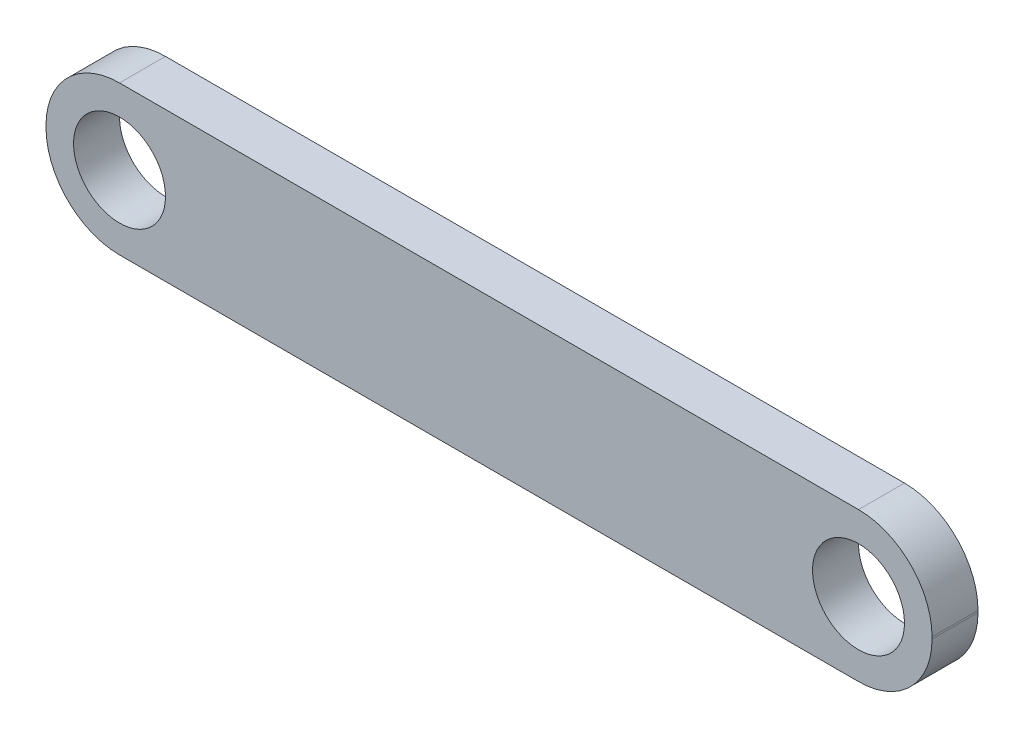
from build123d import *

# Parameters (mm, degrees)
SKETCH1_R           = 10
BOSS_EXTRUDE1_DEPTH = 10


with BuildPart() as part:
    # Sketch1 → Boss-Extrude1 (new body)
    with BuildSketch(Plane.XY):
        with BuildLine():
            Line((-97.749656725, -4.265612127), (63.056011424, -4.265612127))
            ThreePointArc((63.056011424, -4.265612127), (74.369719923, -8.951903628), (79.056011424, -20.265612127))
            Line((79.056011424, -20.265612127), (79.056011424, -20.684264294))
            ThreePointArc((79.056011424, -20.684264294), (74.369719923, -31.997972793), (63.056011424, -36.684264294))
            Line((63.056011424, -36.684264294), (-97.749656725, -36.684264294))
            ThreePointArc((-97.749656725, -36.684264294), (-109.063365224, -31.997972793), (-113.749656725, -20.684264294))
            Line((-113.749656725, -20.684264294), (-113.749656725, -20.265612127))
            ThreePointArc((-113.749656725, -20.265612127), (-109.063365224, -8.951903628), (-97.749656725, -4.265612127))
        make_face()
        with Locations((-97.749656725, -20.684264294)):
            Circle(SKETCH1_R, mode=Mode.SUBTRACT)
        with Locations((63.056011424, -20.684264294)):
            Circle(SKETCH1_R, mode=Mode.SUBTRACT)
    extrude(amount=BOSS_EXTRUDE1_DEPTH)


solid = part.part
